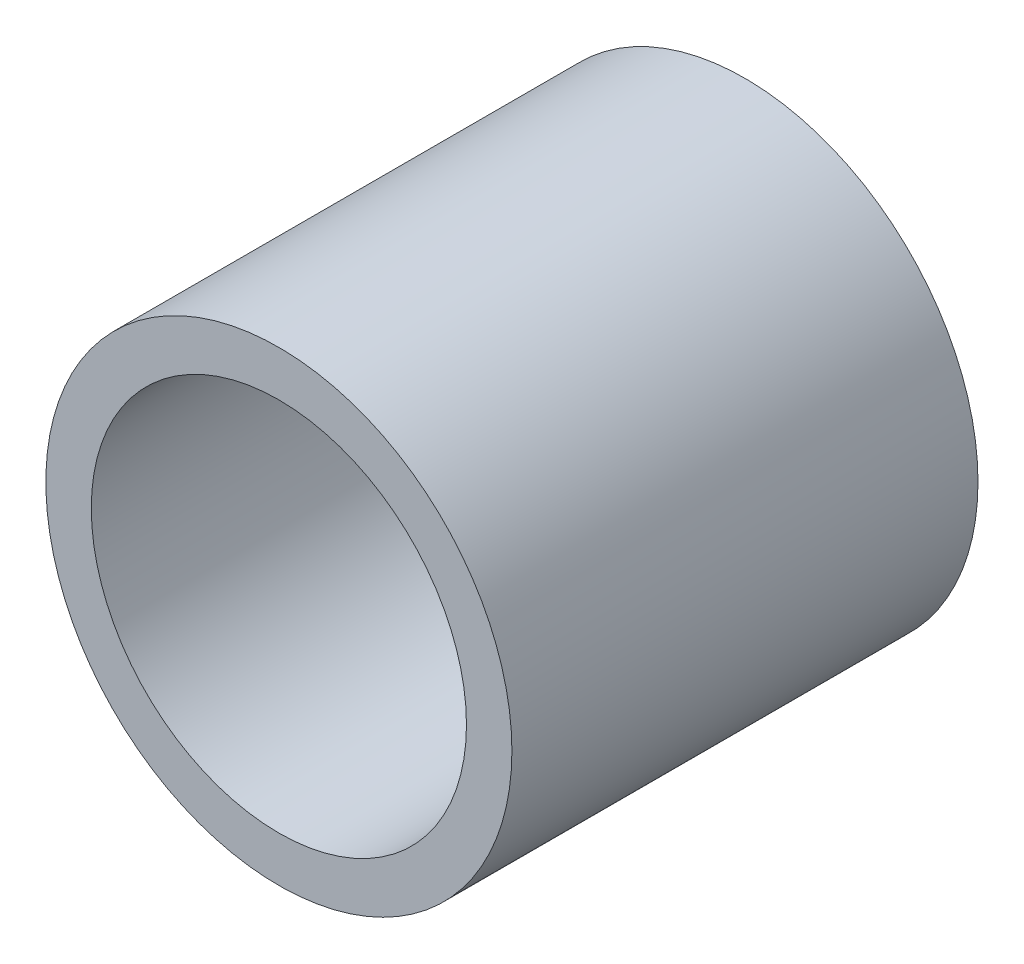
from build123d import *

# Parameters (mm, degrees)
SKETCH1_R           = 5
SKETCH1_R_2         = 4.025
BOSS_EXTRUDE1_DEPTH = 10


with BuildPart() as part:
    # Sketch1 → Boss-Extrude1 (new body)
    with BuildSketch(Plane.XY):
        Circle(SKETCH1_R)
        Circle(SKETCH1_R_2, mode=Mode.SUBTRACT)
    extrude(amount=BOSS_EXTRUDE1_DEPTH)


solid = part.part
